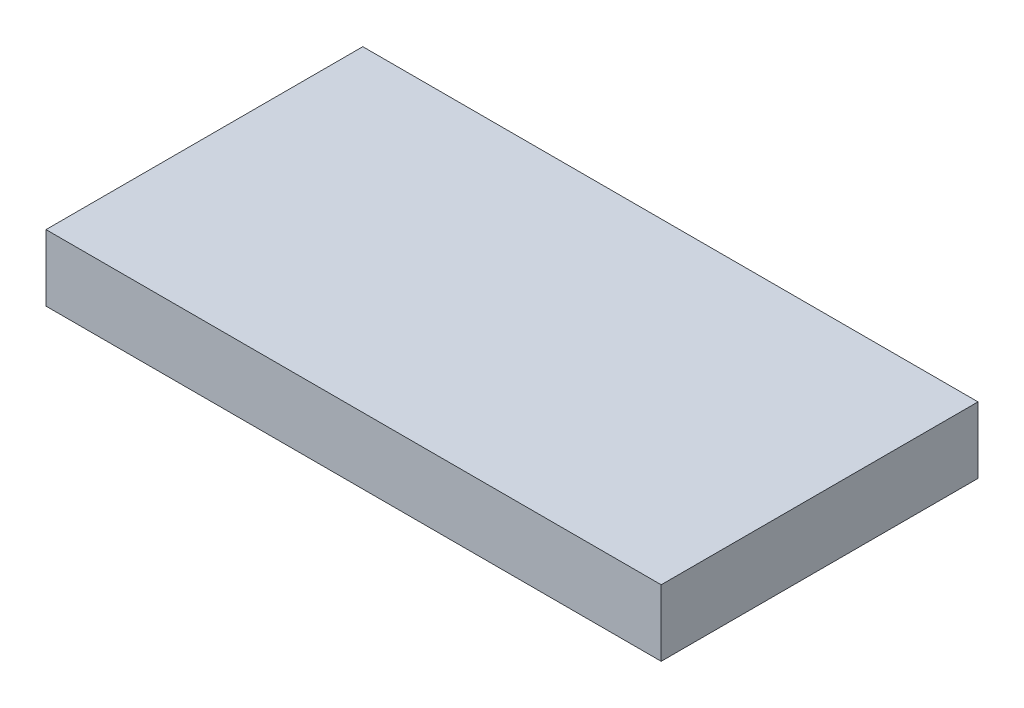
from build123d import *

# Parameters (mm, degrees)
SKETCH1_W           = 167
SKETCH1_H           = 86
BOSS_EXTRUDE1_DEPTH = 18


with BuildPart() as part:
    # Sketch1 → Boss-Extrude1 (new body)
    with BuildSketch(Plane(origin=(0, 0, 0), x_dir=(1, 0, 0), z_dir=(0, 1, 0))):
        with Locations((83.5, 43)):
            Rectangle(SKETCH1_W, SKETCH1_H)
    extrude(amount=BOSS_EXTRUDE1_DEPTH)


solid = part.part
